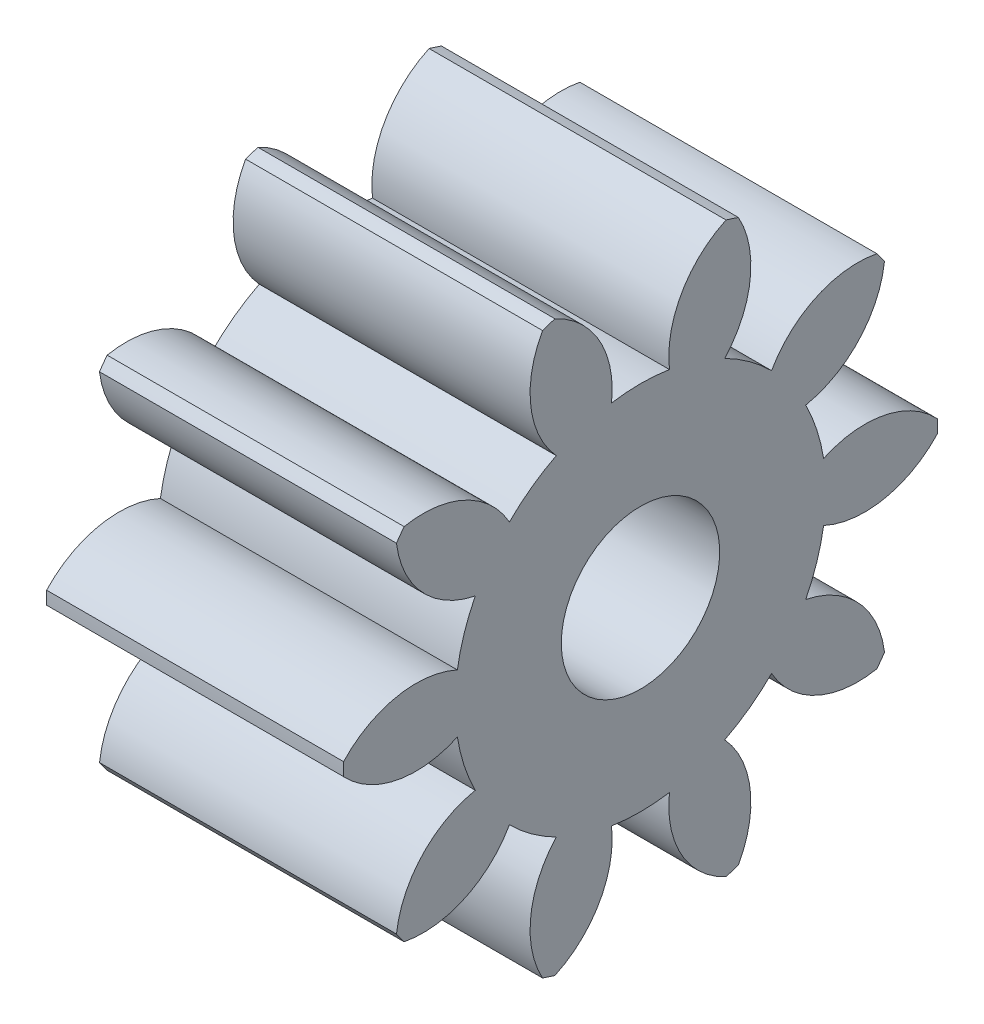
from build123d import *

# Parameters (mm, degrees)
BASPROSKE_W     = 1.5
BASPROSKE_H     = 1.5
TOOTHCUT_DEPTH  = 3.598076211
TEETHCUTS_COUNT = 10
TEETHCUTS_ANGLE = 324
BORSKE_R        = 0.4
BORE_DEPTH      = 50.0000508


with BuildPart() as part:
    # BasProSke → Base-Revolve (revolve)
    with BuildSketch(Plane(origin=(0, 0, 0), x_dir=(1, 0, 0), z_dir=(0, 1, 0)), mode=Mode.PRIVATE) as base_revolve_sk:
        with Locations((0.75, 0.75)):
            Rectangle(BASPROSKE_W, BASPROSKE_H)
    revolve(base_revolve_sk.sketch.rotate(Axis((-10, 0, 0), (1, 0, 0)), 180), axis=Axis((-10, 0, 0), (1, 0, 0)))

    # TooCutSke → ToothCut (cut, through all)
    with BuildSketch(Plane(origin=(0, 0, 0), x_dir=(0, 0, -1), z_dir=(1, 0, 0))):
        with BuildLine():
            ThreePointArc((0.146321185, 0.924998573), (0, 0.9365), (-0.146321185, 0.924998573))
            ThreePointArc((-0.146321185, 0.924998573), (-0.216454601, 1.244005636), (-0.468585949, 1.451644712))
            ThreePointArc((-0.468585949, 1.451644712), (0, 1.5254), (0.468585949, 1.451644712))
            ThreePointArc((0.468585949, 1.451644712), (0.216454601, 1.244005636), (0.146321185, 0.924998573))
        make_face()
    toothcut = extrude(amount=TOOTHCUT_DEPTH, mode=Mode.SUBTRACT)

    # TeethCuts: ToothCut ×10 about axis
    teethcuts_axis = Axis((-10, 0, 0), (1, 0, 0))
    for i in range(1, TEETHCUTS_COUNT):
        add(toothcut.rotate(teethcuts_axis, i * TEETHCUTS_ANGLE / (TEETHCUTS_COUNT - 1)), mode=Mode.SUBTRACT)

    # BorSke → Bore (cut, symmetric)
    with BuildSketch(Plane(origin=(0, 0, 0), x_dir=(0, 0, -1), z_dir=(1, 0, 0))):
        with Locations(Location((0, 0, 0), (0, 0, 180))):
            Circle(BORSKE_R)
    extrude(amount=BORE_DEPTH, both=True, mode=Mode.SUBTRACT)


solid = part.part
